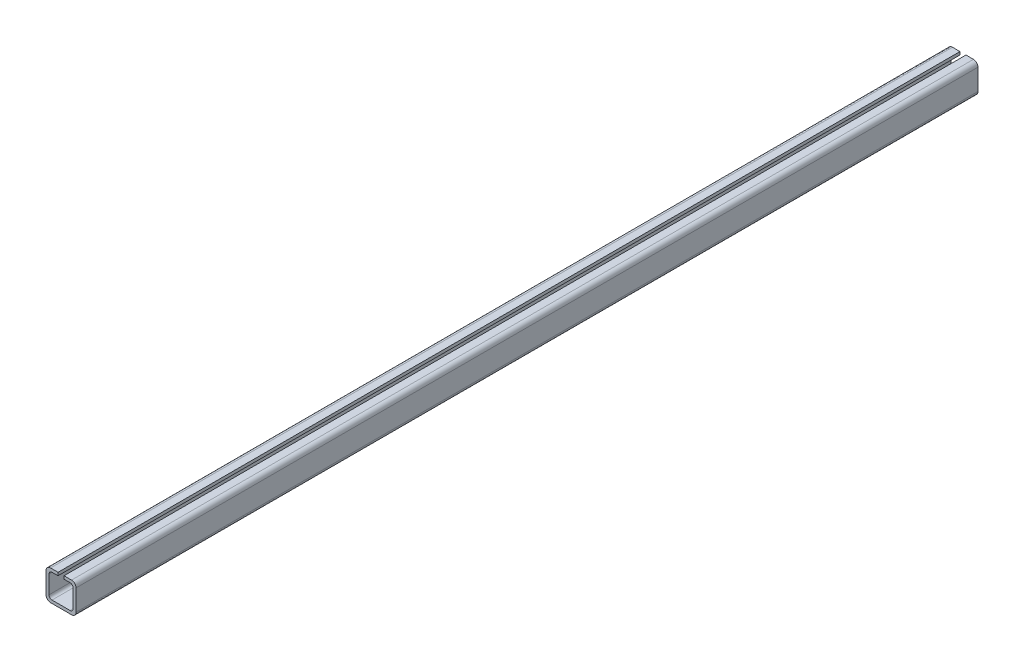
from build123d import *

# Parameters (mm, degrees)
DODANIE_WYCI_GNI_CIE1_DEPTH = 600


with BuildPart() as part:
    # Szkic1 → Dodanie-wyciągnięcie1 (new body)
    with BuildSketch(Plane.XY):
        with BuildLine():
            Line((-10, -7), (-10, 7))
            ThreePointArc((-10, 7), (-9.121320344, 9.121320344), (-7, 10))
            Line((-7, 10), (-2, 10))
            Line((-2, 10), (-2, 8))
            Line((-2, 8), (-6, 8))
            ThreePointArc((-6, 8), (-7.414213562, 7.414213562), (-8, 6))
            Line((-8, 6), (-8, -6))
            ThreePointArc((-8, -6), (-7.414213562, -7.414213562), (-6, -8))
            Line((-6, -8), (6, -8))
            ThreePointArc((6, -8), (7.414213562, -7.414213562), (8, -6))
            Line((8, -6), (8, 6))
            ThreePointArc((8, 6), (7.414213562, 7.414213562), (6, 8))
            Line((6, 8), (2, 8))
            Line((2, 8), (2, 10))
            Line((2, 10), (7, 10))
            ThreePointArc((7, 10), (9.121320344, 9.121320344), (10, 7))
            Line((10, 7), (10, -7))
            ThreePointArc((10, -7), (9.121320344, -9.121320344), (7, -10))
            Line((7, -10), (-7, -10))
            ThreePointArc((-7, -10), (-9.121320344, -9.121320344), (-10, -7))
        make_face()
    extrude(amount=DODANIE_WYCI_GNI_CIE1_DEPTH)


solid = part.part
